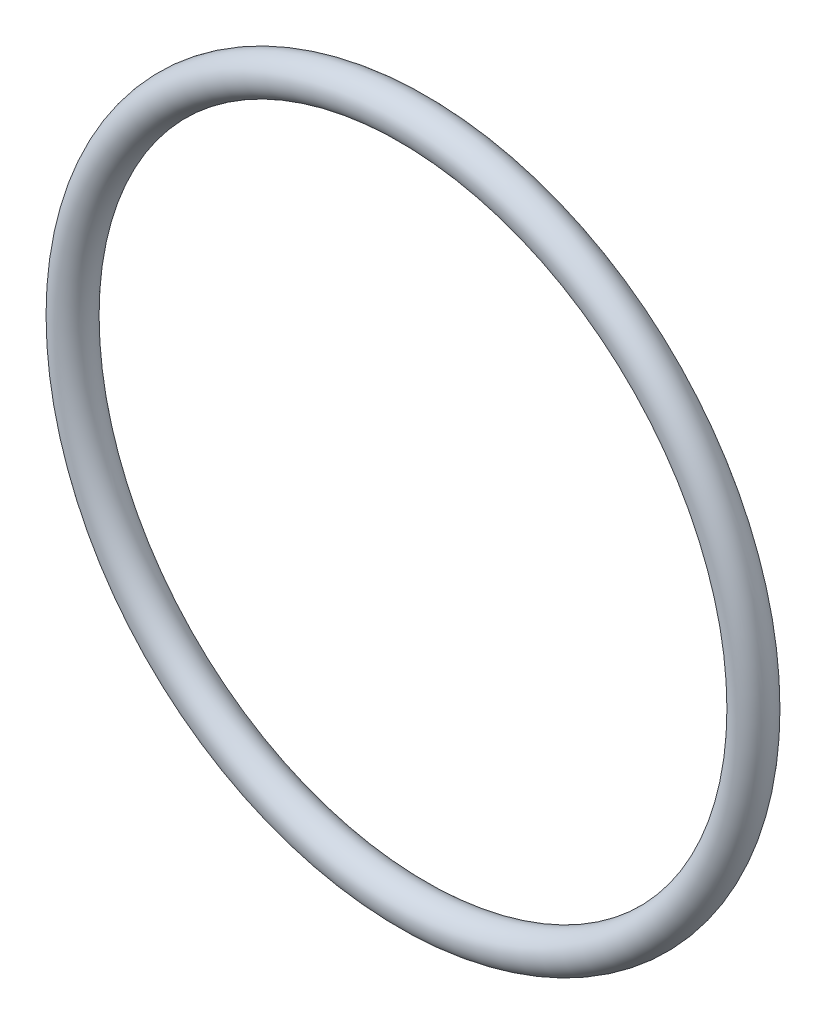
from build123d import *

# Parameters (mm, degrees)
SKETCH1_R = 2.667


with BuildPart() as part:
    # Sketch1 → Revolve1 (revolve)
    with BuildSketch(Plane(origin=(0, 0, 0), x_dir=(0, -1, 0), z_dir=(1, 0, 0)), mode=Mode.PRIVATE) as revolve1_sk:
        with Locations((48.387, 0)):
            Circle(SKETCH1_R)
    revolve(revolve1_sk.sketch.rotate(Axis((0, 0, 2.667), (0, 0, -1)), 270), axis=Axis((0, 0, 2.667), (0, 0, -1)))


solid = part.part
